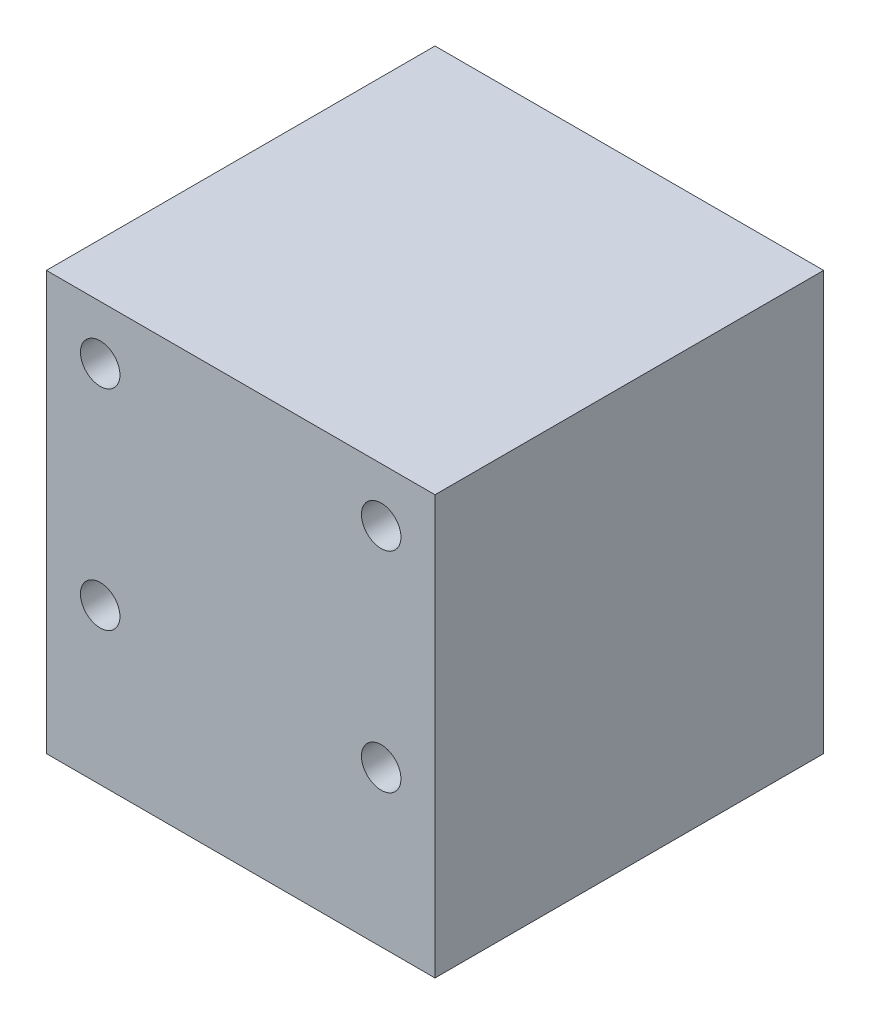
from build123d import *

# Parameters (mm, degrees)
SKETCH_1_W          = 32.5
SKETCH_1_H          = 32.5
EXTRUDE_1_DEPTH     = 35
SKETCH_2_R          = 1.65
CUT_EXTRUDE_1_DEPTH = 5


with BuildPart() as part:
    # 草图1 → 凸台-拉伸1 (new body)
    with BuildSketch(Plane(origin=(0, 0, 0), x_dir=(1, 0, 0), z_dir=(0, 1, 0))):
        with Locations((16.25, 16.25)):
            Rectangle(SKETCH_1_W, SKETCH_1_H)
    extrude(amount=EXTRUDE_1_DEPTH)

    # 草图2 → 切除-拉伸1 (cut)
    with BuildSketch(Plane.XY):
        with Locations((4.5, 30.5)):
            Circle(SKETCH_2_R)
        with Locations((28, 30.5)):
            Circle(SKETCH_2_R)
        with Locations((4.5, 13)):
            Circle(SKETCH_2_R)
        with Locations((28, 13)):
            Circle(SKETCH_2_R)
    extrude(amount=-CUT_EXTRUDE_1_DEPTH, mode=Mode.SUBTRACT)


solid = part.part
